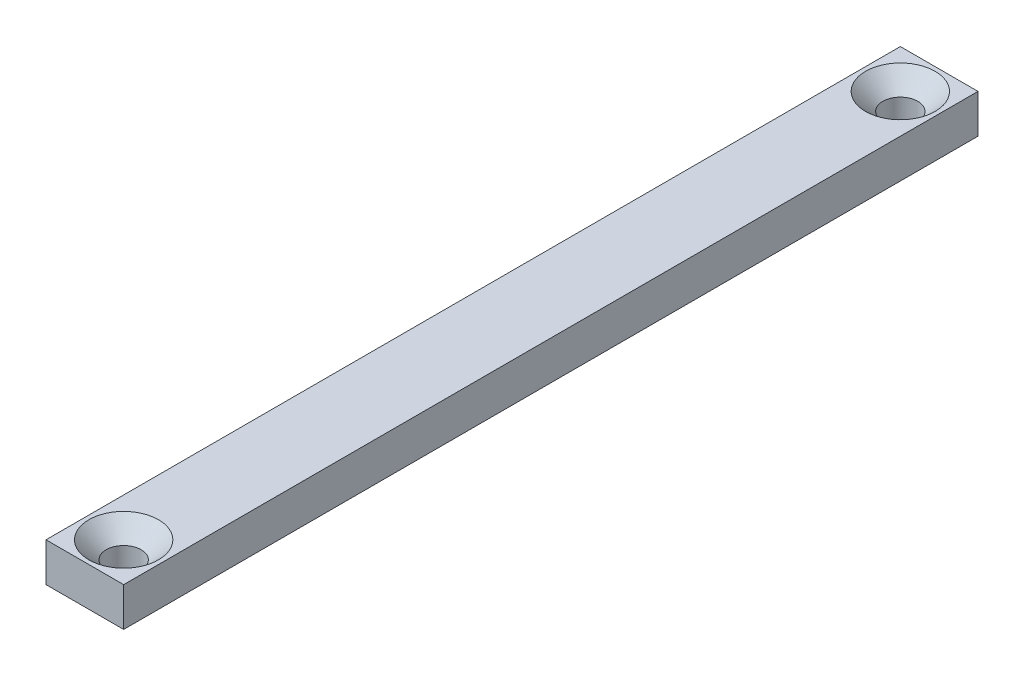
from build123d import *

# Parameters (mm, degrees)
SKETCH1_W                     = 10
SKETCH1_H                     = 110
BOSS_EXTRUDE1_DEPTH           = 5
CSK_FOR_M4_SFHCS1_D           = 4.5
CSK_FOR_M4_SFHCS1_CSINK_D     = 8.96
CSK_FOR_M4_SFHCS1_CSINK_ANGLE = 90


with BuildPart() as part:
    # Sketch1 → Boss-Extrude1 (new body)
    with BuildSketch(Plane(origin=(0, 0, 0), x_dir=(1, 0, 0), z_dir=(0, 1, 0))):
        Rectangle(SKETCH1_W, SKETCH1_H)
    extrude(amount=BOSS_EXTRUDE1_DEPTH)

    # CSK for M4 SFHCS1 (through all)
    with Locations(Plane(origin=(0, 5, 0), x_dir=(1, 0, 0), z_dir=(0, 1, 0))):
        with Locations((0, -50), (0, 50)):
            CounterSinkHole(CSK_FOR_M4_SFHCS1_D / 2, CSK_FOR_M4_SFHCS1_CSINK_D / 2, counter_sink_angle=CSK_FOR_M4_SFHCS1_CSINK_ANGLE)


solid = part.part
